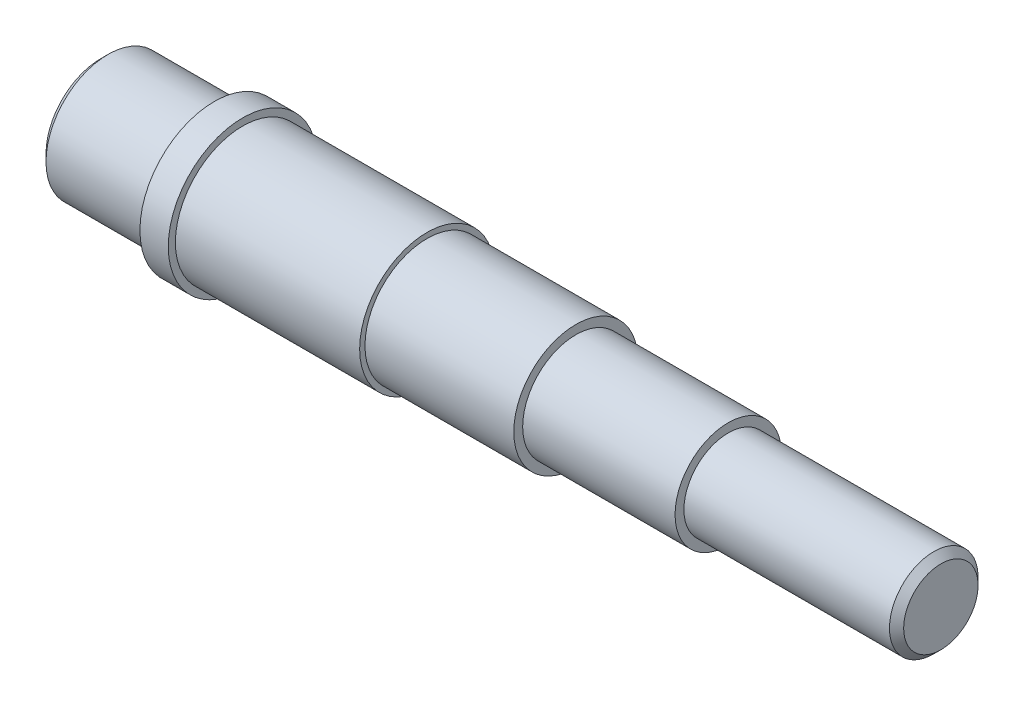
from build123d import *

# Parameters (mm, degrees)
CUT_EXTRUDE_1_DEPTH = 4
CUT_EXTRUDE_2_DEPTH = 5


with BuildPart() as part:
    # 草图1 → 旋转1 (revolve)
    with BuildSketch(Plane(origin=(0, 0, 0), x_dir=(1, 0, 0), z_dir=(0, 1, 0)), mode=Mode.PRIVATE) as revolve_1_sk:
        Polygon((-128.123292873, 0), (-128.123292873, 15.5), (-126.123292873, 17.5), (-96.123292873, 17.5), (-96.123292873, 21), (-88.123292873, 21), (-88.123292873, 19), (-36.123292873, 19), (-36.123292873, 17.5), (5.876707127, 17.5), (5.876707127, 15), (48.876707127, 15), (48.876707127, 12.5), (106.876707127, 12.5), (108.876707127, 10.5), (108.876707127, 0), align=None)
    revolve(revolve_1_sk.sketch.rotate(Axis((-128.123292873, 0, 0), (1, 0, 0)), 180), axis=Axis((-128.123292873, 0, 0), (1, 0, 0)))

    # 草图2 → 切除-拉伸1 (cut)
    with BuildSketch(Plane(origin=(0, 0, -12.5), x_dir=(-1, 0, 0), z_dir=(0, 0, -1))):
        with BuildLine():
            Line((-101.876707127, 4), (-53.876707127, 4))
            ThreePointArc((-53.876707127, 4), (-49.876707127, 0), (-53.876707127, -4))
            Line((-53.876707127, -4), (-101.876707127, -4))
            ThreePointArc((-101.876707127, -4), (-105.876707127, 0), (-101.876707127, 4))
        make_face()
    extrude(amount=-CUT_EXTRUDE_1_DEPTH, mode=Mode.SUBTRACT)

    # 草图3 → 切除-拉伸2 (cut)
    with BuildSketch(Plane(origin=(0, 0, -19), x_dir=(-1, 0, 0), z_dir=(0, 0, -1))):
        with BuildLine():
            Line((44.123292873, 5), (79.123292873, 5))
            ThreePointArc((79.123292873, 5), (84.123292873, 0), (79.123292873, -5))
            Line((79.123292873, -5), (44.123292873, -5))
            ThreePointArc((44.123292873, -5), (39.123292873, 0), (44.123292873, 5))
        make_face()
    extrude(amount=-CUT_EXTRUDE_2_DEPTH, mode=Mode.SUBTRACT)


solid = part.part
